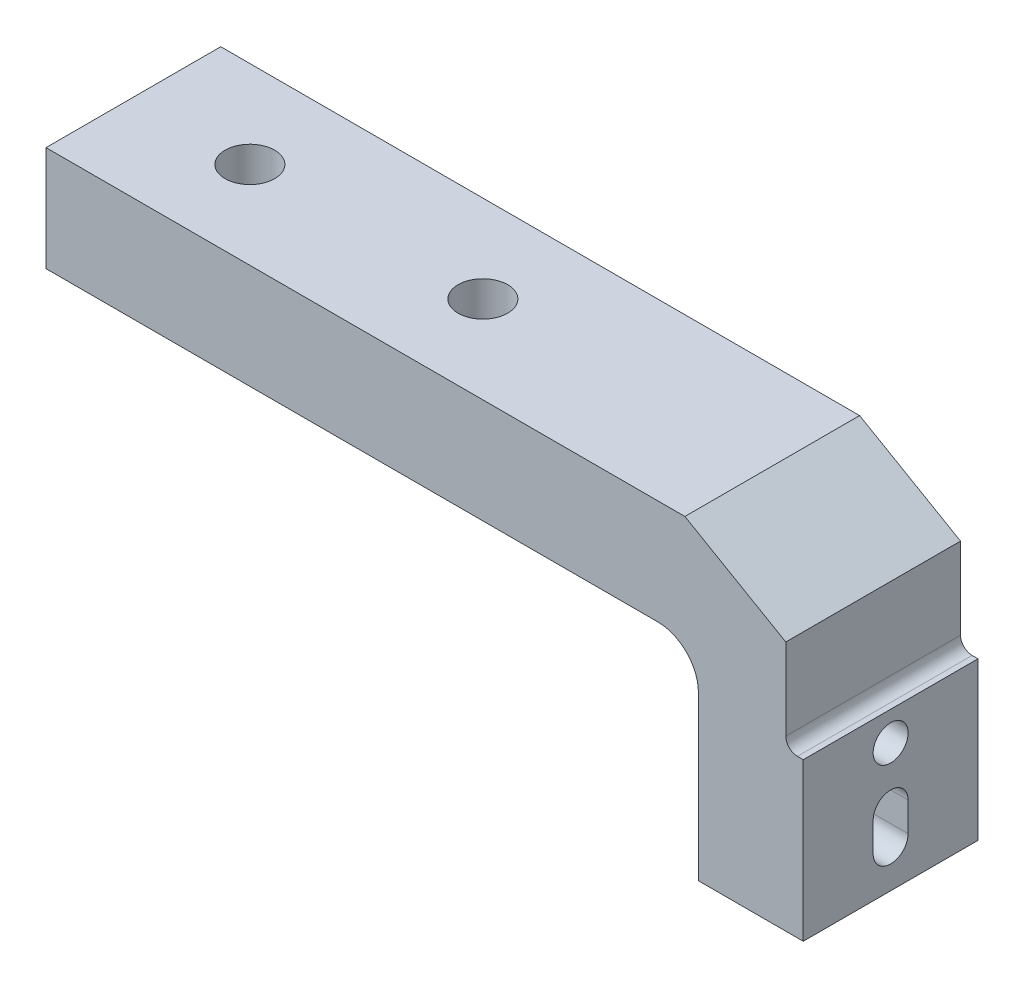
from build123d import *

# Parameters (mm, degrees)
BOSS_EXTRUDE1_DEPTH = 15
CUT_EXTRUDE1_REACH  = 143.188
SKETCH2_R           = 3
SKETCH3_R           = 4.25
CUT_EXTRUDE2_DEPTH  = 30
FILLET3_R           = 7
CHAMFER1_SIZE       = 10
CHAMFER1_SIZE2      = 17.320508076
FILLET4_R           = 2


with BuildPart() as part:
    # Sketch1 → Boss-Extrude1 (new, symmetric)
    with BuildSketch(Plane.XY):
        Polygon((0, 0), (0, 27), (-3, 27), (-3, 53), (-130, 53), (-130, 35), (-18, 35), (-18, 0), align=None)
    extrude(amount=BOSS_EXTRUDE1_DEPTH, both=True)

    # Sketch2 → Cut-Extrude1 (cut, up to next)
    with BuildSketch(Plane(origin=(0, 0, 0), x_dir=(0, 0, -1), z_dir=(1, 0, 0)), mode=Mode.PRIVATE) as cut_extrude1_sk1:
        with Locations((0, 22)):
            Circle(SKETCH2_R)
    cut_extrude1_tool1 = extrude(cut_extrude1_sk1.sketch, amount=-CUT_EXTRUDE1_REACH, mode=Mode.PRIVATE) & part.part
    # Sketch2 → Cut-Extrude1 (cut, up to next)
    with BuildSketch(Plane(origin=(0, 0, 0), x_dir=(0, 0, -1), z_dir=(1, 0, 0)), mode=Mode.PRIVATE) as cut_extrude1_sk2:
        with BuildLine():
            Line((3, 12), (3, 7))
            ThreePointArc((3, 7), (0, 4), (-3, 7))
            Line((-3, 7), (-3, 12))
            ThreePointArc((-3, 12), (0, 15), (3, 12))
        make_face()
    cut_extrude1_tool2 = extrude(cut_extrude1_sk2.sketch, amount=-CUT_EXTRUDE1_REACH, mode=Mode.PRIVATE) & part.part
    add(cut_extrude1_tool1.solids().sort_by_distance((0, 22, 0))[0], mode=Mode.SUBTRACT)
    add(cut_extrude1_tool2.solids().sort_by_distance((0, 9.5, 0))[0], mode=Mode.SUBTRACT)

    # Sketch3 → Cut-Extrude2 (cut)
    with BuildSketch(Plane.XZ.offset(-35)):
        with Locations(Location((-110, 0, 0), (0, 0, 270))):
            Circle(SKETCH3_R)
        with Locations(Location((-70, 0, 0), (0, 0, 270))):
            Circle(SKETCH3_R)
    extrude(amount=-CUT_EXTRUDE2_DEPTH, mode=Mode.SUBTRACT)

    # Fillet3
    fillet3_edges = [part.edges().sort_by_distance(p)[0] for p in [
        (-18, 35, 0),
    ]]
    fillet(fillet3_edges, radius=FILLET3_R)

    # Chamfer1
    chamfer1_edges = [part.edges().sort_by_distance(p)[0] for p in [
        (-3, 53, 0),
    ]]
    chamfer1_side = [part.faces().sort_by_distance(p)[0] for p in [
        (-3, 40, 0),
    ]]
    chamfer(chamfer1_edges, length=CHAMFER1_SIZE, length2=CHAMFER1_SIZE2, reference=chamfer1_side[0])

    # Fillet4
    fillet4_edges = [part.edges().sort_by_distance(p)[0] for p in [
        (-3, 27, 0),
    ]]
    fillet(fillet4_edges, radius=FILLET4_R)


solid = part.part
